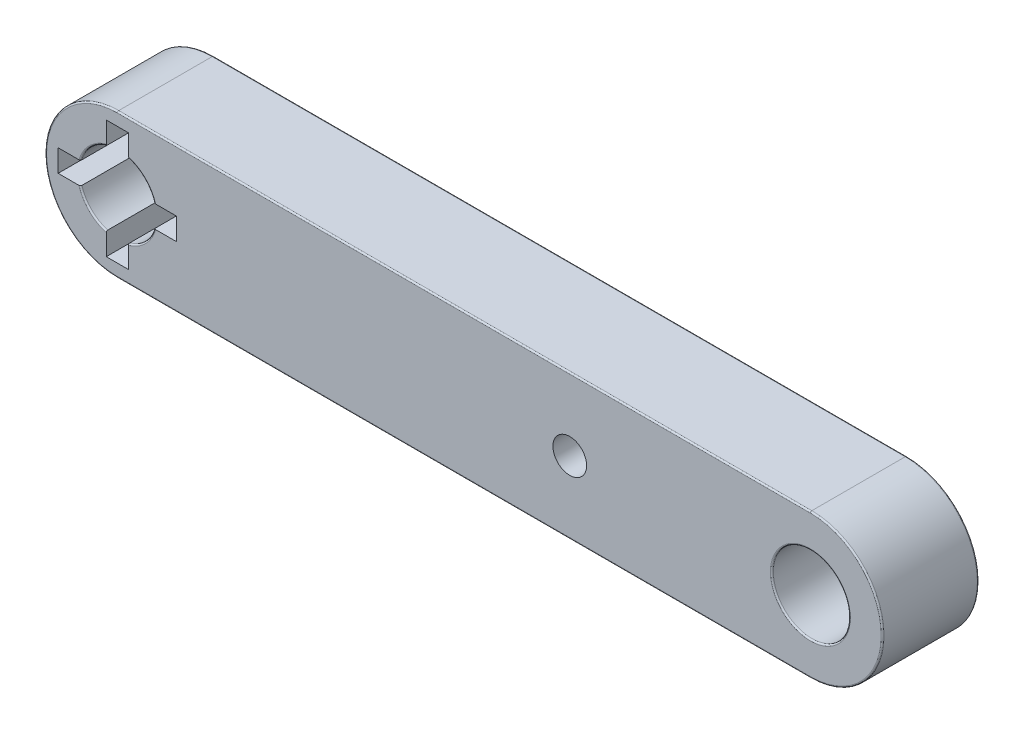
from build123d import *

# Parameters (mm, degrees)
SKETCH1_R           = 4
BOSS_EXTRUDE1_DEPTH = 5
FILLET2_R           = 0.15
SKETCH2_W           = 10
SKETCH2_H           = 7.9994
CUT_EXTRUDE1_DEPTH  = 3
SKETCH3_R           = 1.75
CUT_EXTRUDE2_DEPTH  = 45.69339996
CUT_EXTRUDE3_DEPTH  = 46.260357931


with BuildPart() as part:
    # Sketch1 → Boss-Extrude1 (new, symmetric)
    with BuildSketch(Plane.XY):
        with BuildLine():
            Line((-35.999998845, 7.5), (35.999998845, 7.5))
            ThreePointArc((35.999998845, 7.5), (43.5, 0), (35.999998845, -7.5))
            Line((35.999998845, -7.5), (-35.999998845, -7.5))
            ThreePointArc((-35.999998845, -7.5), (-43.5, 0), (-35.999998845, 7.5))
        make_face()
        with Locations((-36, 0)):
            Circle(SKETCH1_R, mode=Mode.SUBTRACT)
        with Locations((36, 0)):
            Circle(SKETCH1_R, mode=Mode.SUBTRACT)
    extrude(amount=BOSS_EXTRUDE1_DEPTH, both=True)

    # Fillet2
    fillet2_edges = [part.edges().sort_by_distance(p)[0] for p in [
        (-40, 0, -5),
        (-40, 0, 5),
        (-43.5, 0, 5),
        (32, 0, -5),
        (32, 0, 5),
        (0, -7.5, 5),
        (43.5, 0, 5),
        (0, -7.5, -5),
        (-43.5, 0, -5),
        (0, 7.5, -5),
        (43.5, 0, -5),
        (0, 7.5, 5),
    ]]
    fillet(fillet2_edges, radius=FILLET2_R)

    # Sketch2 → Cut-Extrude1 (cut)
    with BuildSketch(Plane(origin=(0, 0, -5), x_dir=(-1, 0, 0), z_dir=(0, 0, -1))):
        with Locations((-11, 0.0003)):
            Rectangle(SKETCH2_W, SKETCH2_H)
    extrude(amount=-CUT_EXTRUDE1_DEPTH, mode=Mode.SUBTRACT)

    # Sketch3 → Cut-Extrude2 (cut, through all)
    with BuildSketch(Plane(origin=(0, 0, -2), x_dir=(-1, 0, 0), z_dir=(0, 0, -1))):
        with Locations((-11, 0.0003)):
            Circle(SKETCH3_R)
    extrude(amount=-CUT_EXTRUDE2_DEPTH, mode=Mode.SUBTRACT)

    # Sketch4 → Cut-Extrude3 (cut, through all)
    with BuildSketch(Plane.XY.offset(5)):
        with BuildLine():
            Line((-29.85, 1.15), (-32.168877449, 1.15))
            ThreePointArc((-32.168877449, 1.15), (-33.171572875, 2.828427125), (-34.85, 3.831122551))
            Line((-34.85, 3.831122551), (-34.85, 6.15))
            Line((-34.85, 6.15), (-37.15, 6.15))
            Line((-37.15, 6.15), (-37.15, 3.831122551))
            ThreePointArc((-37.15, 3.831122551), (-38.828427125, 2.828427125), (-39.831122551, 1.15))
            Line((-39.831122551, 1.15), (-42.15, 1.15))
            Line((-42.15, 1.15), (-42.15, -1.15))
            Line((-42.15, -1.15), (-39.831122551, -1.15))
            ThreePointArc((-39.831122551, -1.15), (-38.828427125, -2.828427125), (-37.15, -3.831122551))
            Line((-37.15, -3.831122551), (-37.15, -6.15))
            Line((-37.15, -6.15), (-34.85, -6.15))
            Line((-34.85, -6.15), (-34.85, -3.831122551))
            ThreePointArc((-34.85, -3.831122551), (-33.171572875, -2.828427125), (-32.168877449, -1.15))
            Line((-32.168877449, -1.15), (-29.85, -1.15))
            Line((-29.85, -1.15), (-29.85, 1.15))
        make_face()
    extrude(amount=-CUT_EXTRUDE3_DEPTH, mode=Mode.SUBTRACT)


solid = part.part
